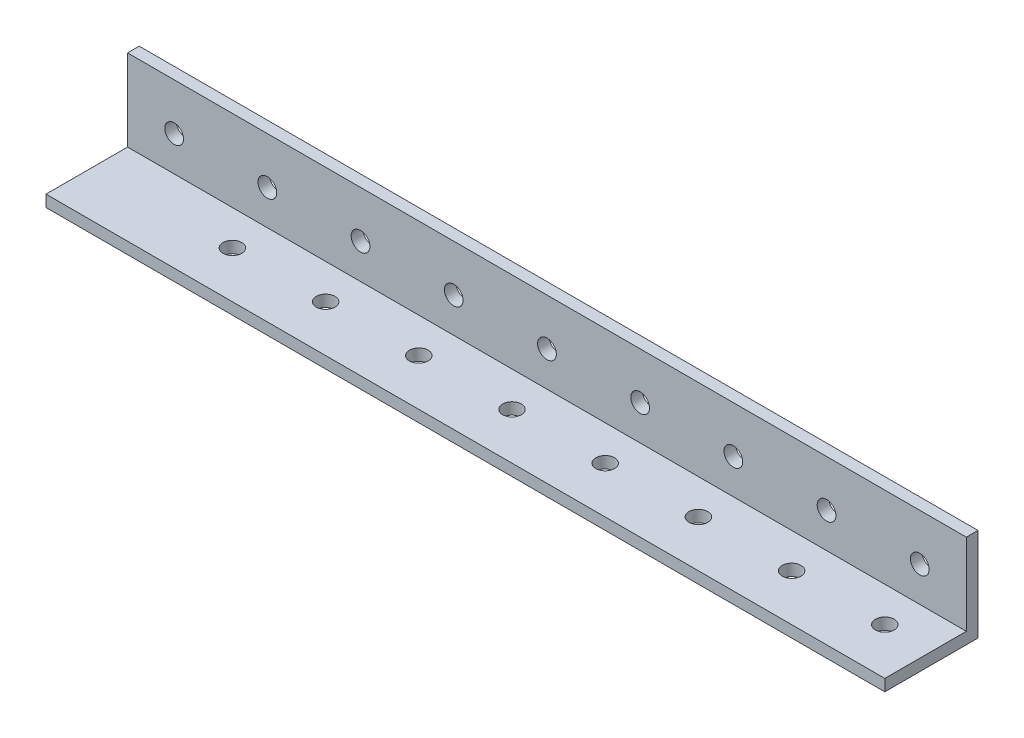
from build123d import *

# Parameters (mm, degrees)
SKETCH1_W                      = 228.6
SKETCH1_H                      = 25.4
BOSS_EXTRUDE1_DEPTH            = 25.4
SKETCH2_W                      = 22.225
SKETCH2_H                      = 22.225
CUT_EXTRUDE1_DEPTH             = 252.44717139
F_7_0_201_DIAMETER_HOLE1_D     = 5.1054
F_7_0_201_DIAMETER_HOLE1_DEPTH = 25.4
F_7_0_201_DIAMETER_HOLE2_D     = 5.1054


with BuildPart() as part:
    # Sketch1 → Boss-Extrude1 (new body)
    with BuildSketch(Plane(origin=(0, 101.6, 0), x_dir=(1, 0, 0), z_dir=(0, 1, 0))):
        with Locations((114.3, -12.7)):
            Rectangle(SKETCH1_W, SKETCH1_H)
    extrude(amount=-BOSS_EXTRUDE1_DEPTH)

    # Sketch2 → Cut-Extrude1 (cut, through all)
    with BuildSketch(Plane(origin=(228.6, 0, 0), x_dir=(0, 0, -1), z_dir=(1, 0, 0))):
        with Locations((-14.2875, 90.4875)):
            Rectangle(SKETCH2_W, SKETCH2_H)
    extrude(amount=-CUT_EXTRUDE1_DEPTH, mode=Mode.SUBTRACT)

    # #7 (0.201) Diameter Hole1
    with Locations(Plane.XZ.offset(-76.2)):
        with Locations((-12.7, -12.7), (38.1, 12.7), (63.5, 12.7), (88.9, 12.7), (114.3, 12.7), (139.7, 12.7), (165.1, 12.7), (190.5, 12.7), (215.9, 12.7)):
            Hole(F_7_0_201_DIAMETER_HOLE1_D / 2, depth=F_7_0_201_DIAMETER_HOLE1_DEPTH)

    # #7 (0.201) Diameter Hole2 (through all)
    with Locations(Plane.XY.offset(3.175)):
        with Locations((12.7, 88.9), (38.1, 88.9), (63.5, 88.9), (88.9, 88.9), (114.3, 88.9), (139.7, 88.9), (165.1, 88.9), (190.5, 88.9), (215.9, 88.9)):
            Hole(F_7_0_201_DIAMETER_HOLE2_D / 2)


solid = part.part
